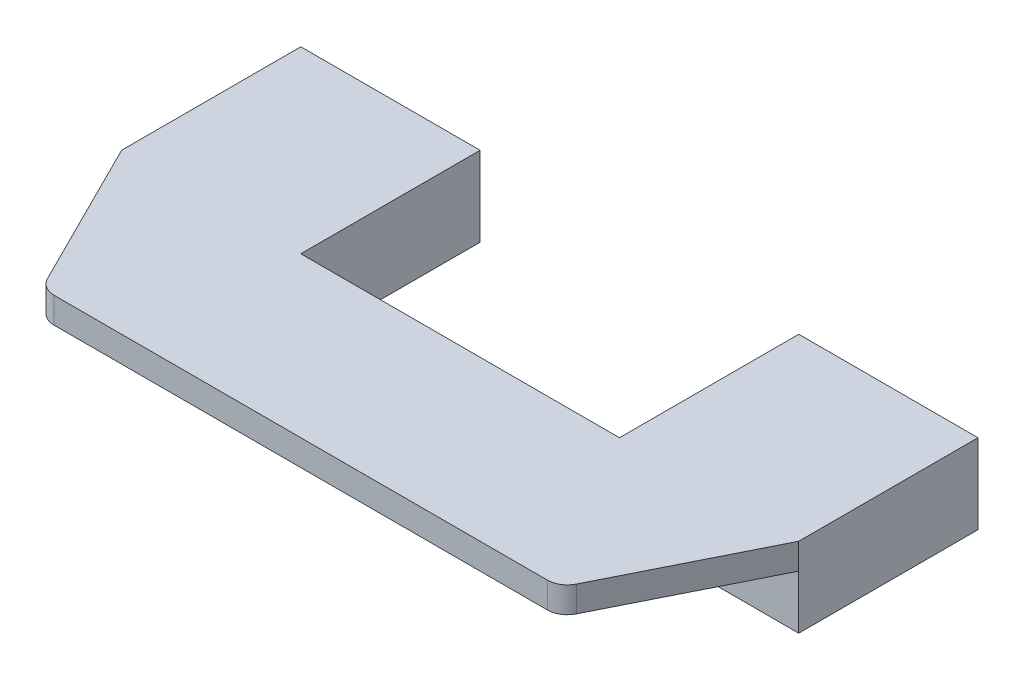
from build123d import *

# Parameters (mm, degrees)
CROQUIS1_W              = 34
CROQUIS1_H              = 17
SALIENTE_EXTRUIR1_DEPTH = 4
CROQUIS2_W              = 16
CROQUIS2_H              = 9
CORTAR_EXTRUIR1_DEPTH   = 5
CROQUIS3_W              = 34
CROQUIS3_H              = 2.7
CORTAR_EXTRUIR2_DEPTH   = 8
CORTAR_EXTRUIR3_DEPTH   = 3
REDONDEO3_R             = 1
REDONDEO4_R             = 1


with BuildPart() as part:
    # Croquis1 → Saliente-Extruir1 (new body)
    with BuildSketch(Plane(origin=(0, 0, 0), x_dir=(1, 0, 0), z_dir=(0, 1, 0))):
        Rectangle(CROQUIS1_W, CROQUIS1_H)
    extrude(amount=SALIENTE_EXTRUIR1_DEPTH)

    # Croquis2 → Cortar-Extruir1 (cut)
    with BuildSketch(Plane(origin=(0, 4, 0), x_dir=(1, 0, 0), z_dir=(0, 1, 0))):
        with Locations((0, 4)):
            Rectangle(CROQUIS2_W, CROQUIS2_H)
    extrude(amount=-CORTAR_EXTRUIR1_DEPTH, mode=Mode.SUBTRACT)

    # Croquis3 → Cortar-Extruir2 (cut)
    with BuildSketch(Plane.XY.offset(8.5)):
        with Locations((0, 1.35)):
            Rectangle(CROQUIS3_W, CROQUIS3_H)
    extrude(amount=-CORTAR_EXTRUIR2_DEPTH, mode=Mode.SUBTRACT)

    # Croquis4 → Cortar-Extruir3 (cut)
    with BuildSketch(Plane(origin=(0, 4, 0), x_dir=(1, 0, 0), z_dir=(0, 1, 0))):
        Polygon((-17, -0.5), (-13, -8.5), (-17, -8.5), align=None)
        Polygon((13, -8.5), (17, -8.5), (17, -0.5), align=None)
    extrude(amount=-CORTAR_EXTRUIR3_DEPTH, mode=Mode.SUBTRACT)

    # Redondeo3
    redondeo3_edges = [part.edges().sort_by_distance(p)[0] for p in [
        (-13, 3.35, 8.5),
    ]]
    fillet(redondeo3_edges, radius=REDONDEO3_R)

    # Redondeo4
    redondeo4_edges = [part.edges().sort_by_distance(p)[0] for p in [
        (13, 3.35, 8.5),
    ]]
    fillet(redondeo4_edges, radius=REDONDEO4_R)


solid = part.part
